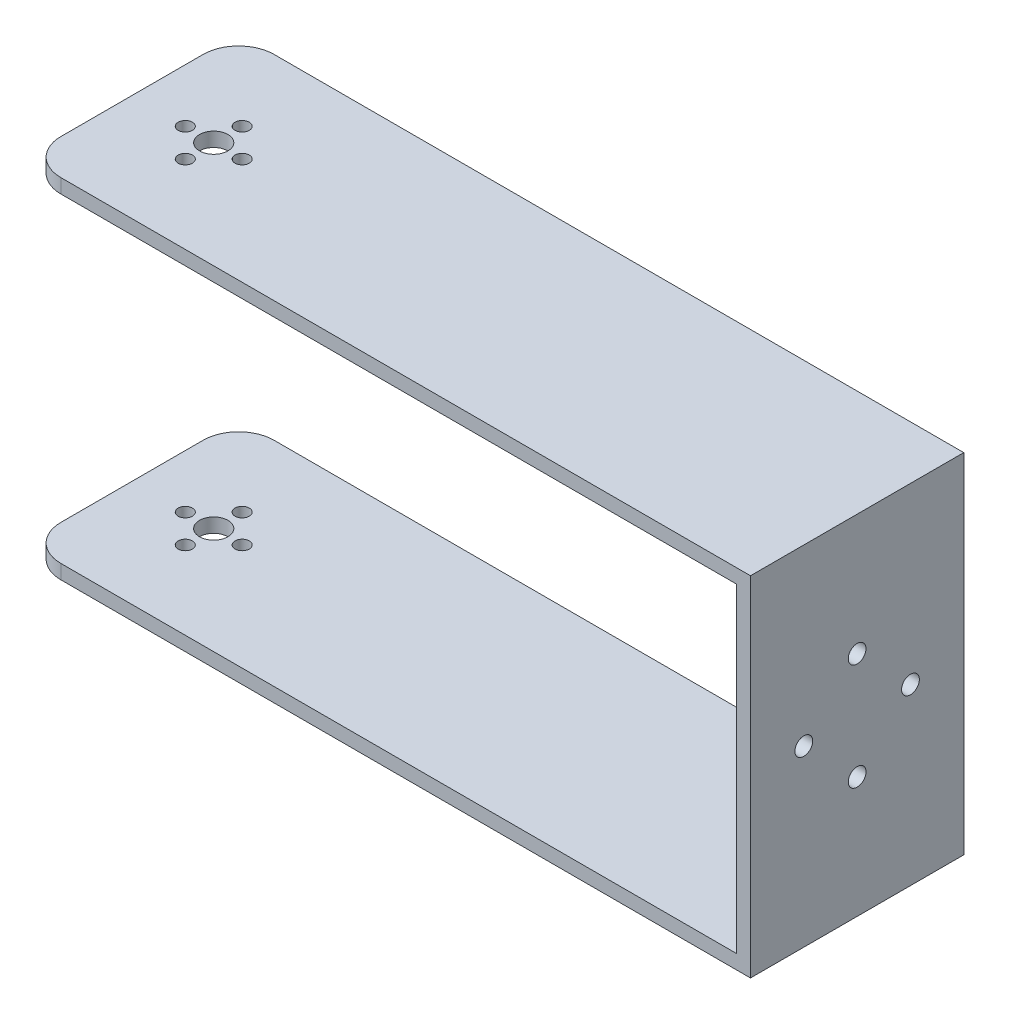
from build123d import *

# Parameters (mm, degrees)
EKSTR_ZYON_NCE1_DEPTH = 60
RADYUS1_R             = 10
KES_EKSTR_ZYON1_REACH = 236.137
IZIM2_R               = 4
IZIM2_R_2             = 2
KES_EKSTR_ZYON2_REACH = 234.491
IZIM3_R               = 2.5


with BuildPart() as part:
    # Çizim1 → Ekstrüzyon-İnce1 (new body)
    with BuildSketch(Plane.XY):
        Polygon((0, 0), (200, 0), (200, 90), (0, 90), (0, 94), (204, 94), (204, -4), (0, -4), align=None)
    extrude(amount=EKSTR_ZYON_NCE1_DEPTH)

    # Radyus1
    radyus1_edges = [part.edges().sort_by_distance(p)[0] for p in [
        (0, -2, 60),
        (0, 92, 60),
        (0, -2, 0),
        (0, 92, 0),
    ]]
    fillet(radyus1_edges, radius=RADYUS1_R)

    # Çizim2 → Kes-Ekstrüzyon1 (cut, up to next)
    with BuildSketch(Plane(origin=(0, 94, 0), x_dir=(1, 0, 0), z_dir=(0, 1, 0)), mode=Mode.PRIVATE) as kes_ekstr_zyon1_sk1:
        with Locations(Location((23, -30, 0), (0, 0, 270))):
            Circle(IZIM2_R)
    kes_ekstr_zyon1_tool1 = extrude(kes_ekstr_zyon1_sk1.sketch, amount=-KES_EKSTR_ZYON1_REACH, mode=Mode.PRIVATE) & part.part
    # Çizim2 → Kes-Ekstrüzyon1 (cut, up to next)
    with BuildSketch(Plane(origin=(0, 94, 0), x_dir=(1, 0, 0), z_dir=(0, 1, 0)), mode=Mode.PRIVATE) as kes_ekstr_zyon1_sk2:
        with Locations(Location((23, -22, 0), (0, 0, 270))):
            Circle(IZIM2_R_2)
    kes_ekstr_zyon1_tool2 = extrude(kes_ekstr_zyon1_sk2.sketch, amount=-KES_EKSTR_ZYON1_REACH, mode=Mode.PRIVATE) & part.part
    # Çizim2 → Kes-Ekstrüzyon1 (cut, up to next)
    with BuildSketch(Plane(origin=(0, 94, 0), x_dir=(1, 0, 0), z_dir=(0, 1, 0)), mode=Mode.PRIVATE) as kes_ekstr_zyon1_sk3:
        with Locations(Location((23, -38, 0), (0, 0, 270))):
            Circle(IZIM2_R_2)
    kes_ekstr_zyon1_tool3 = extrude(kes_ekstr_zyon1_sk3.sketch, amount=-KES_EKSTR_ZYON1_REACH, mode=Mode.PRIVATE) & part.part
    # Çizim2 → Kes-Ekstrüzyon1 (cut, up to next)
    with BuildSketch(Plane(origin=(0, 94, 0), x_dir=(1, 0, 0), z_dir=(0, 1, 0)), mode=Mode.PRIVATE) as kes_ekstr_zyon1_sk4:
        with Locations(Location((31, -30, 0), (0, 0, 270))):
            Circle(IZIM2_R_2)
    kes_ekstr_zyon1_tool4 = extrude(kes_ekstr_zyon1_sk4.sketch, amount=-KES_EKSTR_ZYON1_REACH, mode=Mode.PRIVATE) & part.part
    # Çizim2 → Kes-Ekstrüzyon1 (cut, up to next)
    with BuildSketch(Plane(origin=(0, 94, 0), x_dir=(1, 0, 0), z_dir=(0, 1, 0)), mode=Mode.PRIVATE) as kes_ekstr_zyon1_sk5:
        with Locations(Location((15, -30, 0), (0, 0, 270))):
            Circle(IZIM2_R_2)
    kes_ekstr_zyon1_tool5 = extrude(kes_ekstr_zyon1_sk5.sketch, amount=-KES_EKSTR_ZYON1_REACH, mode=Mode.PRIVATE) & part.part
    kes_ekstr_zyon1_1 = kes_ekstr_zyon1_tool1.solids().sort_by_distance((23, 94, 30))[0]
    add(kes_ekstr_zyon1_1, mode=Mode.SUBTRACT)
    kes_ekstr_zyon1_2 = kes_ekstr_zyon1_tool2.solids().sort_by_distance((23, 94, 22))[0]
    add(kes_ekstr_zyon1_2, mode=Mode.SUBTRACT)
    kes_ekstr_zyon1_3 = kes_ekstr_zyon1_tool3.solids().sort_by_distance((23, 94, 38))[0]
    add(kes_ekstr_zyon1_3, mode=Mode.SUBTRACT)
    kes_ekstr_zyon1_4 = kes_ekstr_zyon1_tool4.solids().sort_by_distance((31, 94, 30))[0]
    add(kes_ekstr_zyon1_4, mode=Mode.SUBTRACT)
    kes_ekstr_zyon1_5 = kes_ekstr_zyon1_tool5.solids().sort_by_distance((15, 94, 30))[0]
    add(kes_ekstr_zyon1_5, mode=Mode.SUBTRACT)
    kes_ekstr_zyon1 = kes_ekstr_zyon1_1 + kes_ekstr_zyon1_2 + kes_ekstr_zyon1_3 + kes_ekstr_zyon1_4 + kes_ekstr_zyon1_5  # Kes-Ekstrüzyon1 as one shape, for the pattern or mirror that repeats it

    # Aynalama1: Kes-Ekstrüzyon1 across plane
    add(kes_ekstr_zyon1.mirror(Plane.ZX.offset(45)), mode=Mode.SUBTRACT)

    # Çizim3 → Kes-Ekstrüzyon2 (cut, up to next)
    with BuildSketch(Plane(origin=(204, 0, 0), x_dir=(0, 0, -1), z_dir=(1, 0, 0)), mode=Mode.PRIVATE) as kes_ekstr_zyon2_sk1:
        with Locations((-30, 60)):
            Circle(IZIM3_R)
    kes_ekstr_zyon2_tool1 = extrude(kes_ekstr_zyon2_sk1.sketch, amount=-KES_EKSTR_ZYON2_REACH, mode=Mode.PRIVATE) & part.part
    # Çizim3 → Kes-Ekstrüzyon2 (cut, up to next)
    with BuildSketch(Plane(origin=(204, 0, 0), x_dir=(0, 0, -1), z_dir=(1, 0, 0)), mode=Mode.PRIVATE) as kes_ekstr_zyon2_sk2:
        with Locations(Location((-30, 30, 0), (0, 0, 180))):
            Circle(IZIM3_R)
    kes_ekstr_zyon2_tool2 = extrude(kes_ekstr_zyon2_sk2.sketch, amount=-KES_EKSTR_ZYON2_REACH, mode=Mode.PRIVATE) & part.part
    # Çizim3 → Kes-Ekstrüzyon2 (cut, up to next)
    with BuildSketch(Plane(origin=(204, 0, 0), x_dir=(0, 0, -1), z_dir=(1, 0, 0)), mode=Mode.PRIVATE) as kes_ekstr_zyon2_sk3:
        with Locations((-15, 45)):
            Circle(IZIM3_R)
    kes_ekstr_zyon2_tool3 = extrude(kes_ekstr_zyon2_sk3.sketch, amount=-KES_EKSTR_ZYON2_REACH, mode=Mode.PRIVATE) & part.part
    # Çizim3 → Kes-Ekstrüzyon2 (cut, up to next)
    with BuildSketch(Plane(origin=(204, 0, 0), x_dir=(0, 0, -1), z_dir=(1, 0, 0)), mode=Mode.PRIVATE) as kes_ekstr_zyon2_sk4:
        with Locations(Location((-45, 45, 0), (0, 0, 180))):
            Circle(IZIM3_R)
    kes_ekstr_zyon2_tool4 = extrude(kes_ekstr_zyon2_sk4.sketch, amount=-KES_EKSTR_ZYON2_REACH, mode=Mode.PRIVATE) & part.part
    add(kes_ekstr_zyon2_tool1.solids().sort_by_distance((204, 60, 30))[0], mode=Mode.SUBTRACT)
    add(kes_ekstr_zyon2_tool2.solids().sort_by_distance((204, 30, 30))[0], mode=Mode.SUBTRACT)
    add(kes_ekstr_zyon2_tool3.solids().sort_by_distance((204, 45, 15))[0], mode=Mode.SUBTRACT)
    add(kes_ekstr_zyon2_tool4.solids().sort_by_distance((204, 45, 45))[0], mode=Mode.SUBTRACT)


solid = part.part
